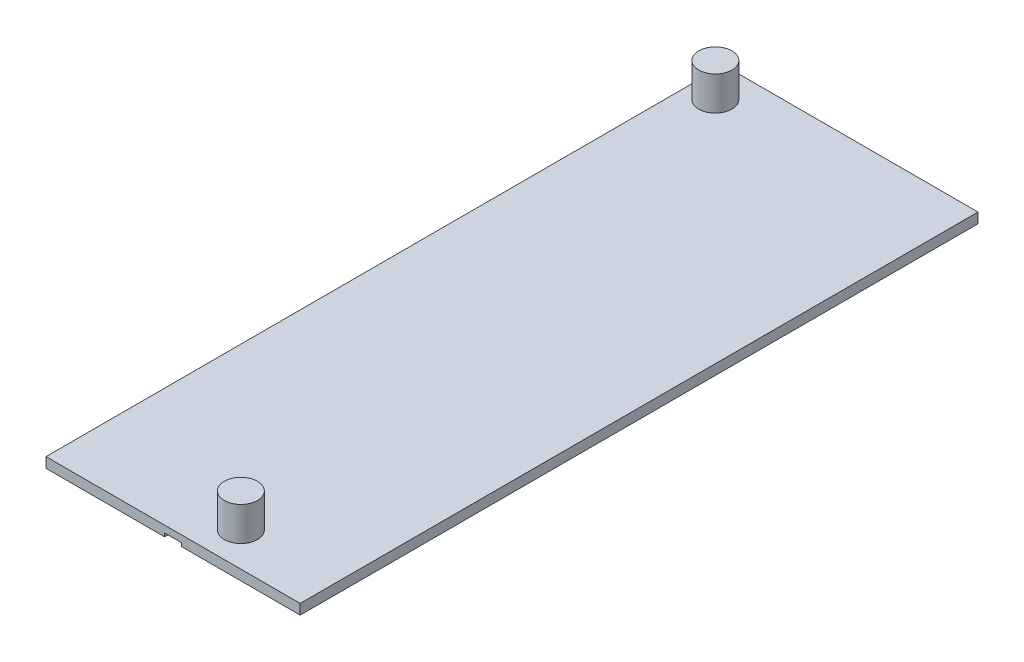
from build123d import *

# Parameters (mm, degrees)
SKETCH1_W           = 75
SKETCH1_H           = 3
BOSS_EXTRUDE1_DEPTH = 200
SKETCH2_R           = 4.9
BOSS_EXTRUDE2_DEPTH = 10
SKETCH3_W           = 5
SKETCH3_H           = 119
CUT_EXTRUDE1_DEPTH  = 1
SKETCH4_W           = 7
SKETCH4_H           = 33
CUT_EXTRUDE2_DEPTH  = 1


with BuildPart() as part:
    # Sketch1 → Boss-Extrude1 (new body)
    with BuildSketch(Plane.XY):
        with Locations((37.5, 1.5)):
            Rectangle(SKETCH1_W, SKETCH1_H)
    extrude(amount=BOSS_EXTRUDE1_DEPTH)

    # Sketch2 → Boss-Extrude2 (add)
    with BuildSketch(Plane(origin=(0, 3, 0), x_dir=(1, 0, 0), z_dir=(0, 1, 0))):
        with Locations(Location((7.5, -10, 0), (0, 0, 90))):
            Circle(SKETCH2_R)
        with Locations(Location((47.5, -190, 0), (0, 0, 90))):
            Circle(SKETCH2_R)
    extrude(amount=BOSS_EXTRUDE2_DEPTH)

    # Sketch3 → Cut-Extrude1 (cut)
    with BuildSketch(Plane.XZ):
        with Locations((37.5, 140.5)):
            Rectangle(SKETCH3_W, SKETCH3_H)
    extrude(amount=-CUT_EXTRUDE1_DEPTH, mode=Mode.SUBTRACT)

    # Sketch4 → Cut-Extrude2 (cut)
    with BuildSketch(Plane.XZ):
        with Locations((7.5, 26.5)):
            Rectangle(SKETCH4_W, SKETCH4_H)
        with Locations((7.5, 63.5)):
            Rectangle(SKETCH4_W, SKETCH4_H)
        with Locations((22.5, 26.5)):
            Rectangle(SKETCH4_W, SKETCH4_H)
        with Locations((22.5, 63.5)):
            Rectangle(SKETCH4_W, SKETCH4_H)
        with Locations((37.5, 26.5)):
            Rectangle(SKETCH4_W, SKETCH4_H)
        with Locations((37.5, 63.5)):
            Rectangle(SKETCH4_W, SKETCH4_H)
        with Locations((52.5, 26.5)):
            Rectangle(SKETCH4_W, SKETCH4_H)
        with Locations((52.5, 63.5)):
            Rectangle(SKETCH4_W, SKETCH4_H)
        with Locations((67.5, 26.5)):
            Rectangle(SKETCH4_W, SKETCH4_H)
        with Locations((67.5, 63.5)):
            Rectangle(SKETCH4_W, SKETCH4_H)
    extrude(amount=-CUT_EXTRUDE2_DEPTH, mode=Mode.SUBTRACT)


solid = part.part
